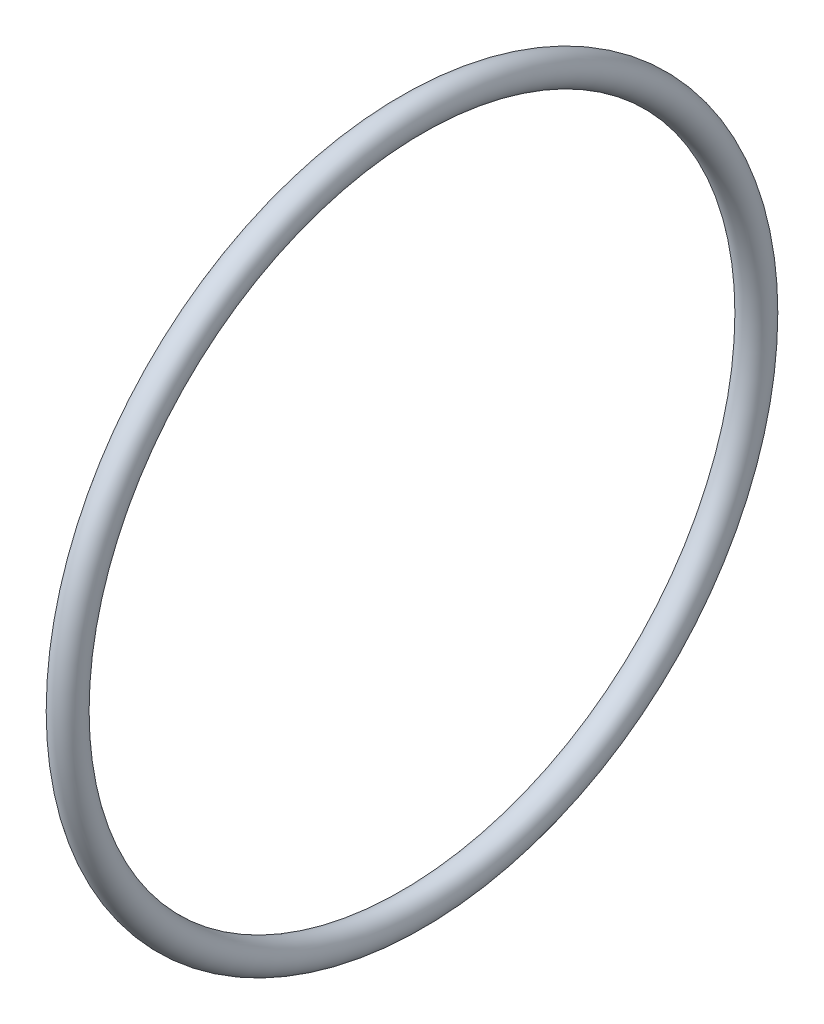
from build123d import *

# Parameters (mm, degrees)
SKETCH2_R = 1.5875


with BuildPart() as part:
    # Sketch2 → Revolve1 (revolve)
    with BuildSketch(Plane.XY, mode=Mode.PRIVATE) as revolve1_sk:
        with Locations((0, 36)):
            Circle(SKETCH2_R)
    revolve(revolve1_sk.sketch.rotate(Axis((0, 0, 0), (1, 0, 0)), 90), axis=Axis((0, 0, 0), (1, 0, 0)))


solid = part.part
